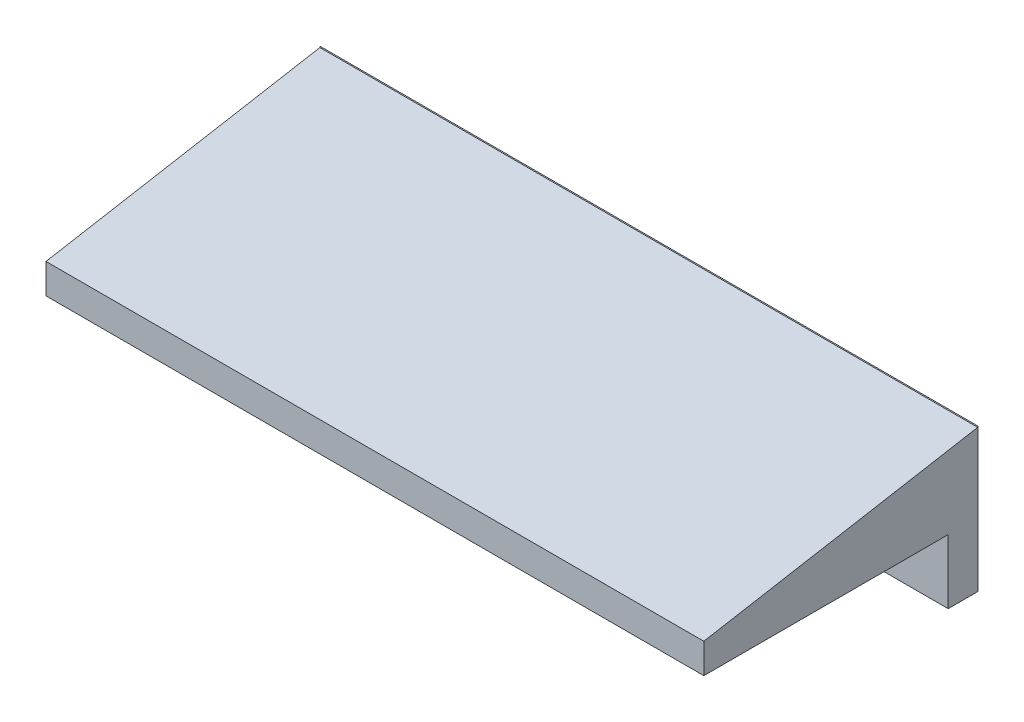
from build123d import *

# Parameters (mm, degrees)
SKETCH1_W           = 70
SKETCH1_H           = 26
BOSS_EXTRUDE1_DEPTH = 3.175
SKETCH2_W           = 70
SKETCH2_H           = 10
BOSS_EXTRUDE2_DEPTH = 3.175
SKETCH3_R           = 1.6
CUT_EXTRUDE1_DEPTH  = 3.175
BOSS_EXTRUDE3_DEPTH = 70
SKETCH5_W           = 28
SKETCH5_H           = 6.825
CUT_EXTRUDE2_DEPTH  = 10


with BuildPart() as part:
    # Sketch1 → Boss-Extrude1 (new body)
    with BuildSketch(Plane(origin=(0, 0, 0), x_dir=(1, 0, 0), z_dir=(0, 1, 0))):
        Rectangle(SKETCH1_W, SKETCH1_H)
    extrude(amount=BOSS_EXTRUDE1_DEPTH)

    # Sketch2 → Boss-Extrude2 (add)
    with BuildSketch(Plane(origin=(0, 0, -13), x_dir=(-1, 0, 0), z_dir=(0, 0, -1))):
        with Locations((0, -1.825)):
            Rectangle(SKETCH2_W, SKETCH2_H)
    extrude(amount=BOSS_EXTRUDE2_DEPTH)

    # Sketch3 → Cut-Extrude1 (cut)
    with BuildSketch(Plane.XY.offset(-13)):
        with Locations((-14.914, -3.825)):
            Circle(SKETCH3_R)
        with Locations((28.575, -3.825)):
            Circle(SKETCH3_R)
        with Locations((-28.575, -3.825)):
            Circle(SKETCH3_R)
    extrude(amount=-CUT_EXTRUDE1_DEPTH, mode=Mode.SUBTRACT)

    # Sketch4 → Boss-Extrude3 (add)
    with BuildSketch(Plane(origin=(35, 0, 0), x_dir=(0, 0, -1), z_dir=(1, 0, 0))):
        Polygon((16.175, 3.175), (16.175, 8.412812241), (16.143192443, 8.313731132), (-13, 3.175), align=None)
    extrude(amount=-BOSS_EXTRUDE3_DEPTH)

    # Sketch5 → Cut-Extrude2 (cut)
    with BuildSketch(Plane(origin=(0, 0, -16.175), x_dir=(-1, 0, 0), z_dir=(0, 0, -1))):
        with Locations((-11, -3.4125)):
            Rectangle(SKETCH5_W, SKETCH5_H)
    extrude(amount=-CUT_EXTRUDE2_DEPTH, mode=Mode.SUBTRACT)


solid = part.part
